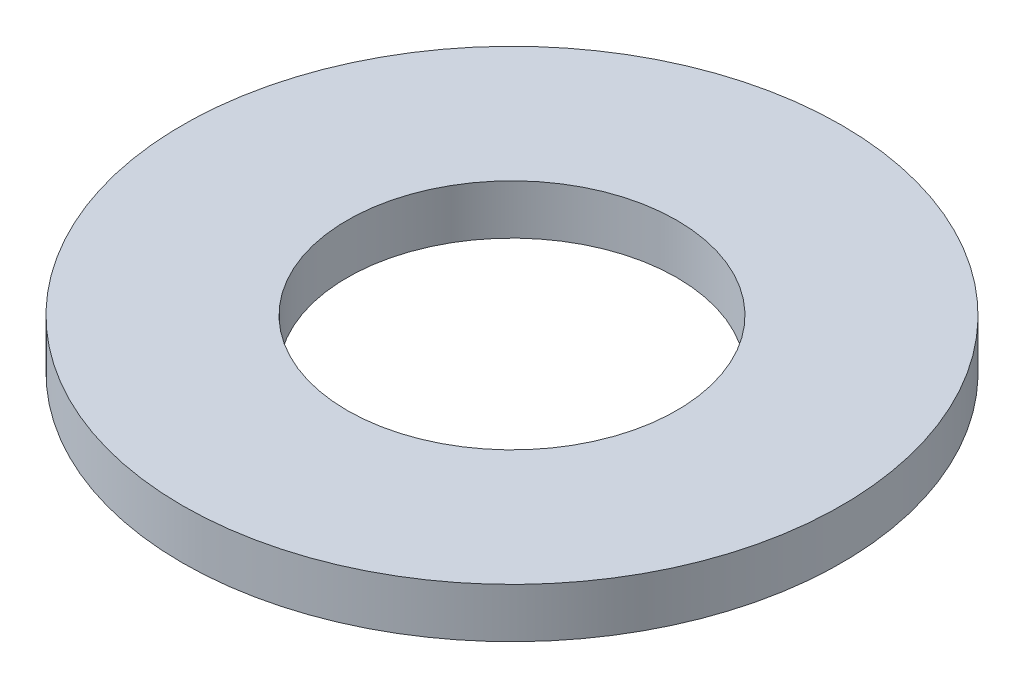
from build123d import *

# Parameters (mm, degrees)
SKETCH1_R           = 13.49375
BOSS_EXTRUDE1_DEPTH = 2.032
SKETCH5_R           = 6.746875
CUT_EXTRUDE1_DEPTH  = 20.190924994


with BuildPart() as part:
    # Sketch1 → Boss-Extrude1 (new body)
    with BuildSketch(Plane(origin=(0, 0, 0), x_dir=(1, 0, 0), z_dir=(0, 1, 0))):
        with Locations(Location((0, 0, 0), (0, 0, 270))):
            Circle(SKETCH1_R)
    extrude(amount=BOSS_EXTRUDE1_DEPTH)

    # Sketch5 → Cut-Extrude1 (cut, through all)
    with BuildSketch(Plane(origin=(0, 2.032, 0), x_dir=(-1, 0, 0), z_dir=(0, 1, 0))):
        with Locations(Location((0, 0, 0), (0, 0, 90))):
            Circle(SKETCH5_R)
    extrude(amount=-CUT_EXTRUDE1_DEPTH, mode=Mode.SUBTRACT)


solid = part.part
